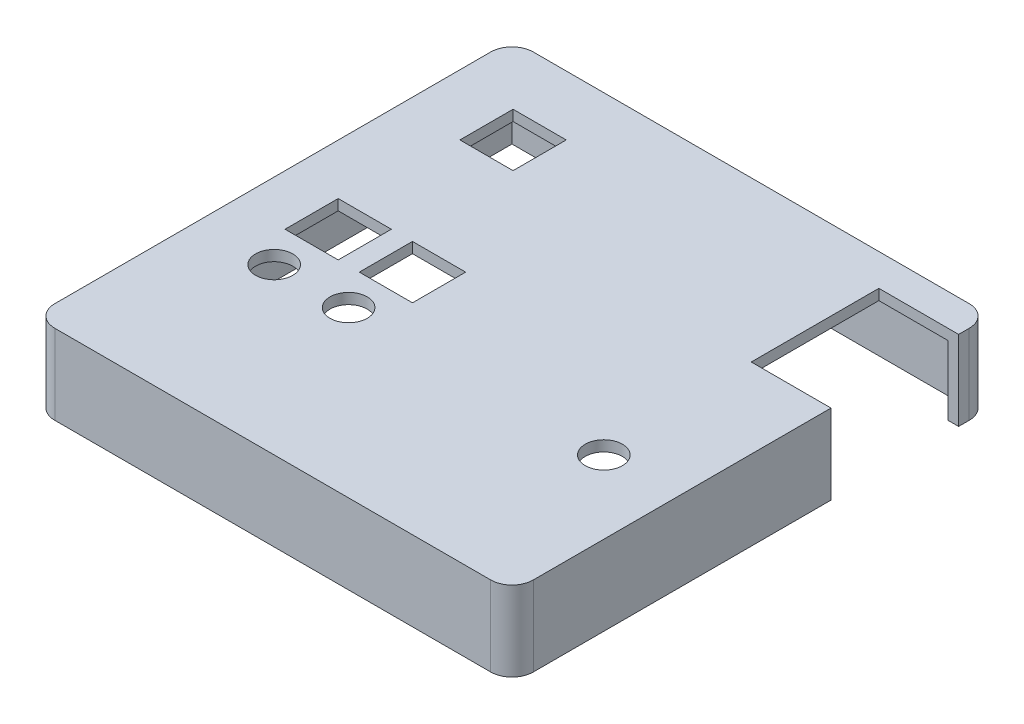
from build123d import *

# Parameters (mm, degrees)
SKETCH1_W           = 90
SKETCH1_H           = 90
BOSS_EXTRUDE1_DEPTH = 15
SKETCH2_W           = 24
SKETCH2_H           = 15
CUT_EXTRUDE1_DEPTH  = 15
SHELL1_T            = -2
SKETCH3_R           = 3.5
CUT_EXTRUDE2_DEPTH  = 4
SKETCH4_W           = 10
SKETCH4_H           = 10
CUT_EXTRUDE3_DEPTH  = 4
FILLET1_R           = 4


with BuildPart() as part:
    # Sketch1 → Boss-Extrude1 (new body)
    with BuildSketch(Plane(origin=(0, 0, 0), x_dir=(1, 0, 0), z_dir=(0, 1, 0))):
        with Locations((45, 45)):
            Rectangle(SKETCH1_W, SKETCH1_H)
    extrude(amount=-BOSS_EXTRUDE1_DEPTH)

    # Sketch2 → Cut-Extrude1 (cut)
    with BuildSketch(Plane(origin=(90, 0, 0), x_dir=(0, 0, -1), z_dir=(1, 0, 0))):
        with Locations((72, -7.5)):
            Rectangle(SKETCH2_W, SKETCH2_H)
    extrude(amount=-CUT_EXTRUDE1_DEPTH, mode=Mode.SUBTRACT)

    # Shell1
    shell1_openings = [part.faces().sort_by_distance(p)[0] for p in [
        (43.255813953, -15, -43.744186047),
        (82.5, -7.5, -60),
        (82.5, -7.5, -84),
        (75, -7.5, -72),
    ]]
    offset(amount=SHELL1_T, openings=shell1_openings, kind=Kind.INTERSECTION)

    # Sketch3 → Cut-Extrude2 (cut)
    with BuildSketch(Plane(origin=(0, 0, 0), x_dir=(1, 0, 0), z_dir=(0, 1, 0))):
        with Locations(Location((14.27, 31, 0), (0, 0, 270))):
            Circle(SKETCH3_R)
        with Locations(Location((28.27, 31, 0), (0, 0, 270))):
            Circle(SKETCH3_R)
        with Locations(Location((76.27, 31, 0), (0, 0, 270))):
            Circle(SKETCH3_R)
    extrude(amount=-CUT_EXTRUDE2_DEPTH, mode=Mode.SUBTRACT)

    # Sketch4 → Cut-Extrude3 (cut)
    with BuildSketch(Plane(origin=(0, 0, 0), x_dir=(1, 0, 0), z_dir=(0, 1, 0))):
        with Locations((14.53, 42.78)):
            Rectangle(SKETCH4_W, SKETCH4_H)
        with Locations((28.5, 42.78)):
            Rectangle(SKETCH4_W, SKETCH4_H)
        with Locations((16.43, 73.77)):
            Rectangle(SKETCH4_W, SKETCH4_H)
    extrude(amount=-CUT_EXTRUDE3_DEPTH, mode=Mode.SUBTRACT)

    # Fillet1
    fillet1_edges = [part.edges().sort_by_distance(p)[0] for p in [
        (0, -7.5, -90),
        (90, -7.5, -90),
        (90, -7.5, 0),
        (0, -7.5, 0),
    ]]
    fillet(fillet1_edges, radius=FILLET1_R)


solid = part.part
